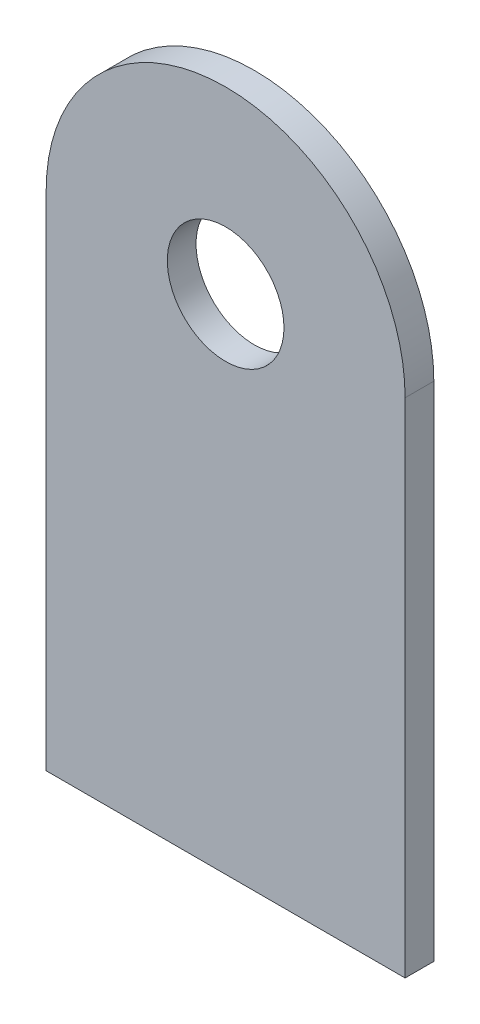
from build123d import *

# Parameters (mm, degrees)
SKETCH2_R           = 2.5796875
BOSS_EXTRUDE1_DEPTH = 1.27


with BuildPart() as part:
    # Sketch2 → Boss-Extrude1 (new body)
    with BuildSketch(Plane.XY):
        with BuildLine():
            ThreePointArc((0, 22.225), (7.9375, 30.1625), (15.875, 22.225))
            Line((15.875, 22.225), (15.875, 0))
            Line((15.875, 0), (0, 0))
            Line((0, 0), (0, 22.225))
        make_face()
        with Locations((7.9375, 22.225)):
            Circle(SKETCH2_R, mode=Mode.SUBTRACT)
    extrude(amount=BOSS_EXTRUDE1_DEPTH)


solid = part.part
